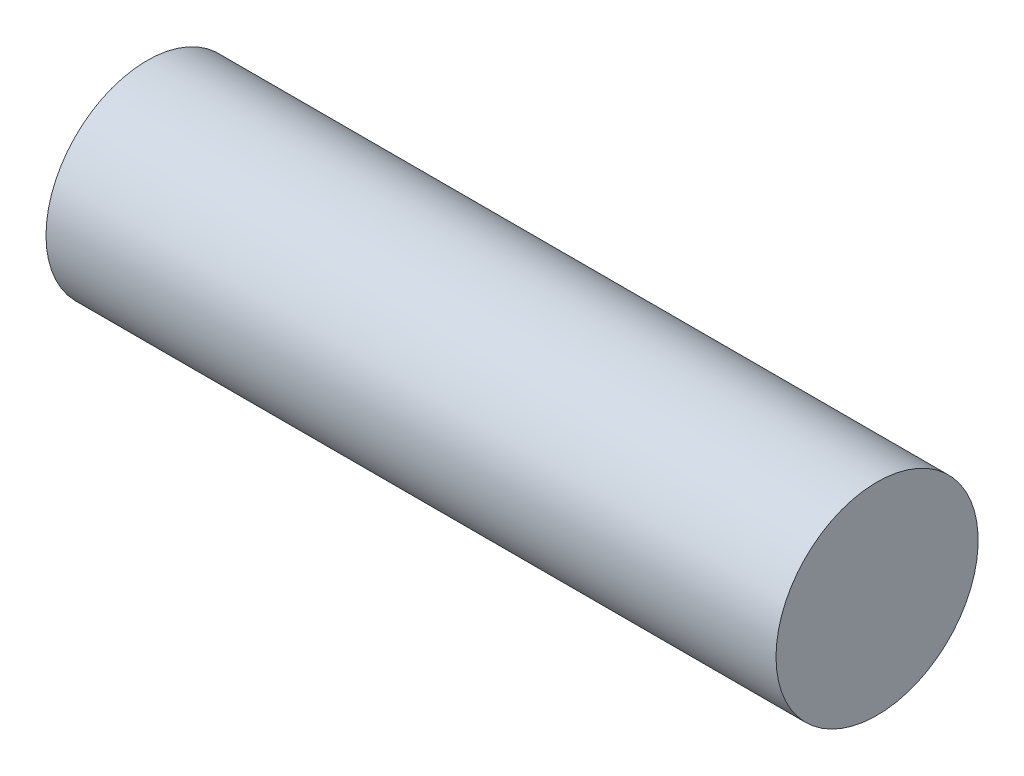
from build123d import *

# Parameters (mm, degrees)
SKETCH_1_W = 65
SKETCH_1_H = 9


with BuildPart() as part:
    # Эскиз1 → Повернуть1 (revolve)
    with BuildSketch(Plane(origin=(0, 0, 0), x_dir=(1, 0, 0), z_dir=(0, 1, 0)), mode=Mode.PRIVATE) as revolve_1_sk:
        with Locations((0.878378378, 4.5)):
            Rectangle(SKETCH_1_W, SKETCH_1_H)
    revolve(revolve_1_sk.sketch.rotate(Axis((-39, 0, 0), (1, 0, 0)), 180), axis=Axis((-39, 0, 0), (1, 0, 0)))


solid = part.part
